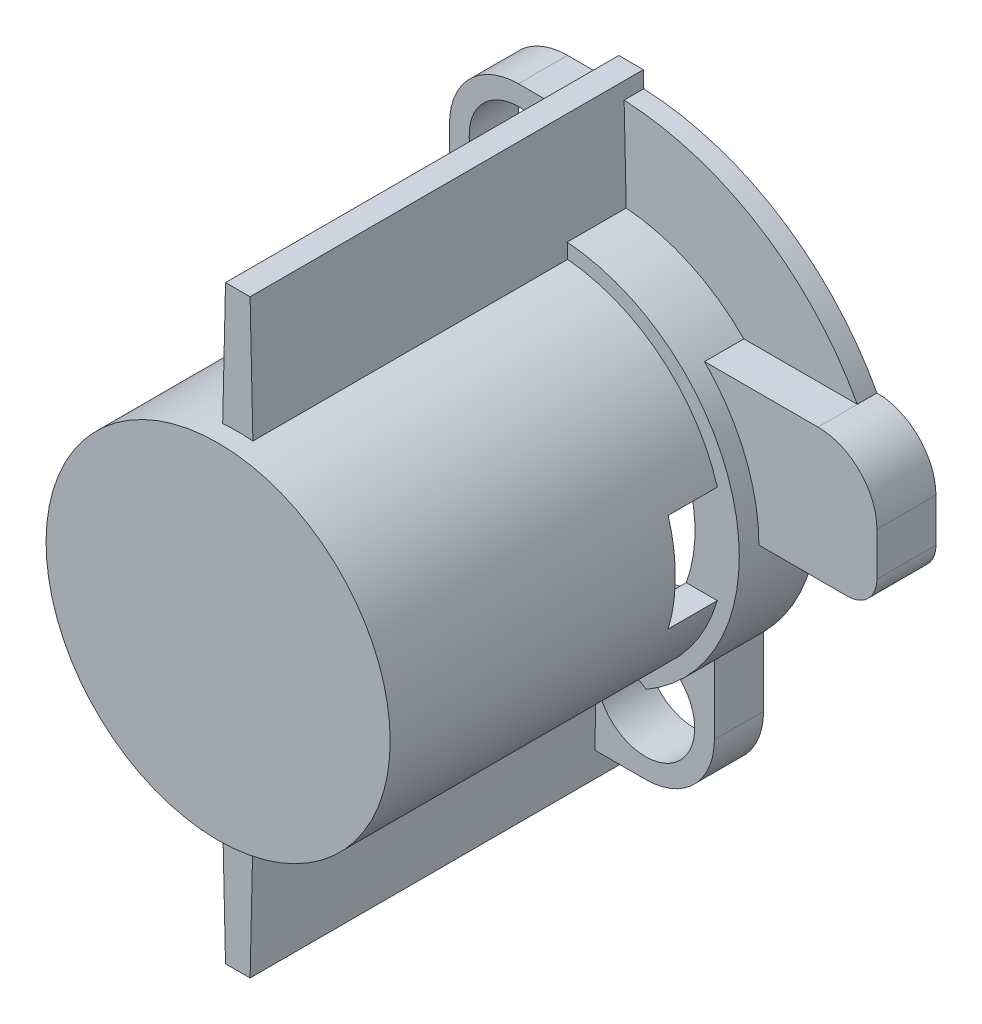
from build123d import *

# Parameters (mm, degrees)
BOSS_EXTRUDE1_DEPTH   = 5
BOSS_EXTRUDE1_2_DEPTH = 5
BOSS_EXTRUDE2_DEPTH   = 40
BOSS_EXTRUDE3_DEPTH   = 42
BOSS_EXTRUDE4_DEPTH   = 8
BOSS_EXTRUDE5_DEPTH   = 6
BOSS_EXTRUDE6_DEPTH   = 2
FILLET1_R             = 7
BOSS_EXTRUDE7_DEPTH   = 42
SKETCH2_R             = 14.5
CUT_EXTRUDE1_DEPTH    = 40
SKETCH3_W             = 5
SKETCH3_H             = 10
CUT_EXTRUDE2_DEPTH    = 40


with BuildPart() as part:
    # Sketch1 → Boss-Extrude1 (new body)
    with BuildSketch(Plane.XY):
        with BuildLine():
            Line((-13.47, 27.399966418), (-13.47, 13.399966418))
            ThreePointArc((-13.47, 13.399966418), (-11.596936091, 15.050284825), (-9.523675037, 16.440791154))
            ThreePointArc((-9.523675037, 16.440791154), (-8.624614178, 24.911910317), (-1.471296976, 20.286088952))
            Line((-1.471296976, 20.286088952), (-1.309232534, 27.399966418))
            Line((-1.309232534, 27.399966418), (-13.47, 27.399966418))
        make_face()
    extrude(amount=BOSS_EXTRUDE1_DEPTH)



with BuildPart() as body_2:
    # Sketch1 → Boss-Extrude1 2 (new body)
    with BuildSketch(Plane.XY):
        with BuildLine():
            Line((1.471296984, -20.286088587), (1.309232534, -27.399966418))
            Line((1.309232534, -27.399966418), (13.47, -27.399966418))
            Line((13.47, -27.399966418), (13.47, -13.399966418))
            ThreePointArc((13.47, -13.399966418), (11.596936091, -15.050284825), (9.523675037, -16.440791154))
            ThreePointArc((9.523675037, -16.440791154), (8.624614013, -24.911910395), (1.471296984, -20.286088587))
        make_face()
    extrude(amount=BOSS_EXTRUDE1_2_DEPTH)


with BuildPart() as part_1:
    add(part.part)

    add(body_2.part)  # Boss-Extrude2 merges body 2
    # Sketch1<3> → Boss-Extrude2 (add)
    with BuildSketch(Plane.XY):
        with BuildLine():
            Line((-1.25, 30), (-1.53630737, 17.432434129))
            ThreePointArc((-1.53630737, 17.432434129), (0, 17.5), (1.53630737, 17.432434129))
            Line((1.53630737, 17.432434129), (1.25, 30))
            Line((1.25, 30), (-1.25, 30))
        make_face()
        with BuildLine():
            Line((-1.53630737, -17.432434129), (-1.25, -30))
            Line((-1.25, -30), (1.25, -30))
            Line((1.25, -30), (1.53630737, -17.432434129))
            ThreePointArc((1.53630737, -17.432434129), (0, -17.5), (-1.53630737, -17.432434129))
        make_face()
    extrude(amount=BOSS_EXTRUDE2_DEPTH)

    # Sketch1<4> → Boss-Extrude3 (add)
    with BuildSketch(Plane.XY):
        with BuildLine():
            ThreePointArc((-7.908141071, 15.611255708), (-16.68113138, -5.290544005), (2.534806328, -17.315448504))
            ThreePointArc((2.534806328, -17.315448504), (4.958415999, -15.633928881), (7.908141071, -15.611255708))
            ThreePointArc((7.908141071, -15.611255708), (16.68113138, 5.290544005), (-2.534806328, 17.315448504))
            ThreePointArc((-2.534806328, 17.315448504), (-4.958415999, 15.633928881), (-7.908141071, 15.611255708))
        make_face()
    extrude(amount=BOSS_EXTRUDE3_DEPTH)

    # Sketch1<5> → Boss-Extrude4 (add)
    with BuildSketch(Plane.XY):
        with BuildLine():
            ThreePointArc((-9.523675037, 16.440791154), (-18.529727325, -4.201095719), (-1.501950478, -18.940542357))
            Line((-1.501950478, -18.940542357), (-1.53630737, -17.432434129))
            ThreePointArc((-1.53630737, -17.432434129), (-17.18344439, -3.313493457), (-7.908141071, 15.611255708))
            ThreePointArc((-7.908141071, 15.611255708), (-8.753885998, 15.952060759), (-9.523675037, 16.440791154))
        make_face()
        with BuildLine():
            ThreePointArc((-1.471296976, 20.286088952), (-1.76257993, 18.714678227), (-2.534806328, 17.315448504))
            ThreePointArc((-2.534806328, 17.315448504), (-2.036397087, 17.381112936), (-1.53630737, 17.432434129))
            Line((-1.53630737, 17.432434129), (-1.471296976, 20.286088952))
        make_face()
        with BuildLine():
            Line((1.501950478, 18.940542357), (1.53630737, 17.432434129))
            ThreePointArc((1.53630737, 17.432434129), (17.18344439, 3.313493457), (7.908141071, -15.611255708))
            ThreePointArc((7.908141071, -15.611255708), (8.753885998, -15.952060759), (9.523675037, -16.440791154))
            ThreePointArc((9.523675037, -16.440791154), (18.529727325, 4.201095719), (1.501950478, 18.940542357))
        make_face()
        with BuildLine():
            ThreePointArc((2.534806328, -17.315448504), (2.036397087, -17.381112936), (1.53630737, -17.432434129))
            Line((1.53630737, -17.432434129), (1.471296984, -20.286088587))
            ThreePointArc((1.471296984, -20.286088587), (1.762579992, -18.714678055), (2.534806328, -17.315448504))
        make_face()
    extrude(amount=BOSS_EXTRUDE4_DEPTH)

    # Sketch1<6> → Boss-Extrude5 (add)
    with BuildSketch(Plane.XY):
        with BuildLine():
            ThreePointArc((-13.47, -13.399966418), (-17.563171695, -7.2481032), (-19, 0))
            Line((-19, 0), (-28, 0))
            ThreePointArc((-28, 0), (-30.121320344, -0.878679656), (-31, -3))
            Line((-31, -3), (-31, -7.399966418))
            ThreePointArc((-31, -7.399966418), (-29.242640687, -11.642607105), (-25, -13.399966418))
            Line((-25, -13.399966418), (-13.47, -13.399966418))
        make_face()
        with BuildLine():
            Line((25, 13.399966418), (13.47, 13.399966418))
            ThreePointArc((13.47, 13.399966418), (17.563171695, 7.2481032), (19, 0))
            Line((19, 0), (28, 0))
            ThreePointArc((28, 0), (30.121320344, 0.878679656), (31, 3))
            Line((31, 3), (31, 7.399966418))
            ThreePointArc((31, 7.399966418), (29.242640687, 11.642607105), (25, 13.399966418))
        make_face()
    extrude(amount=BOSS_EXTRUDE5_DEPTH)

    # Sketch1<7> → Boss-Extrude6 (add)
    with BuildSketch(Plane.XY):
        with BuildLine():
            ThreePointArc((-1.501950478, -18.940542357), (-7.982125075, -17.241974344), (-13.47, -13.399966418))
            Line((-13.47, -13.399966418), (-25, -13.399966418))
            ThreePointArc((-25, -13.399966418), (-15.117248317, -24.000581312), (-1.287919802, -28.335496512))
            Line((-1.287919802, -28.335496512), (-1.501950478, -18.940542357))
        make_face()
        with BuildLine():
            Line((1.287919802, 28.335496512), (1.501950478, 18.940542357))
            ThreePointArc((1.501950478, 18.940542357), (7.982125075, 17.241974344), (13.47, 13.399966418))
            Line((13.47, 13.399966418), (25, 13.399966418))
            ThreePointArc((25, 13.399966418), (15.117248317, 24.000581312), (1.287919802, 28.335496512))
        make_face()
    extrude(amount=BOSS_EXTRUDE6_DEPTH)

    # Fillet1
    fillet1_edges = [part_1.edges().sort_by_distance(p)[0] for p in [
        (13.47, -27.399966418, 2.5),
        (-13.47, 27.399966418, 2.5),
    ]]
    fillet(fillet1_edges, radius=FILLET1_R)

    # Sketch1<8> → Boss-Extrude7 (add)
    with BuildSketch(Plane.XY):
        with BuildLine():
            ThreePointArc((-2.534806328, 17.315448504), (-5.290544005, 16.68113138), (-7.908141071, 15.611255708))
            ThreePointArc((-7.908141071, 15.611255708), (-4.958415999, 15.633928881), (-2.534806328, 17.315448504))
        make_face()
        with BuildLine():
            ThreePointArc((7.908141071, -15.611255708), (4.958415999, -15.633928881), (2.534806328, -17.315448504))
            ThreePointArc((2.534806328, -17.315448504), (5.290544005, -16.68113138), (7.908141071, -15.611255708))
        make_face()
    extrude(amount=BOSS_EXTRUDE7_DEPTH)

    # Sketch2 → Cut-Extrude1 (cut)
    with BuildSketch(Plane(origin=(0, 0, 0), x_dir=(-1, 0, 0), z_dir=(0, 0, -1))):
        Circle(SKETCH2_R)
    extrude(amount=-CUT_EXTRUDE1_DEPTH, mode=Mode.SUBTRACT)

    # Sketch3 → Cut-Extrude2 (cut)
    with BuildSketch(Plane.ZY.offset(17.5)):
        with Locations((10.5, 0)):
            Rectangle(SKETCH3_W, SKETCH3_H)
    extrude(amount=-CUT_EXTRUDE2_DEPTH, mode=Mode.SUBTRACT)


solid = part_1.part
